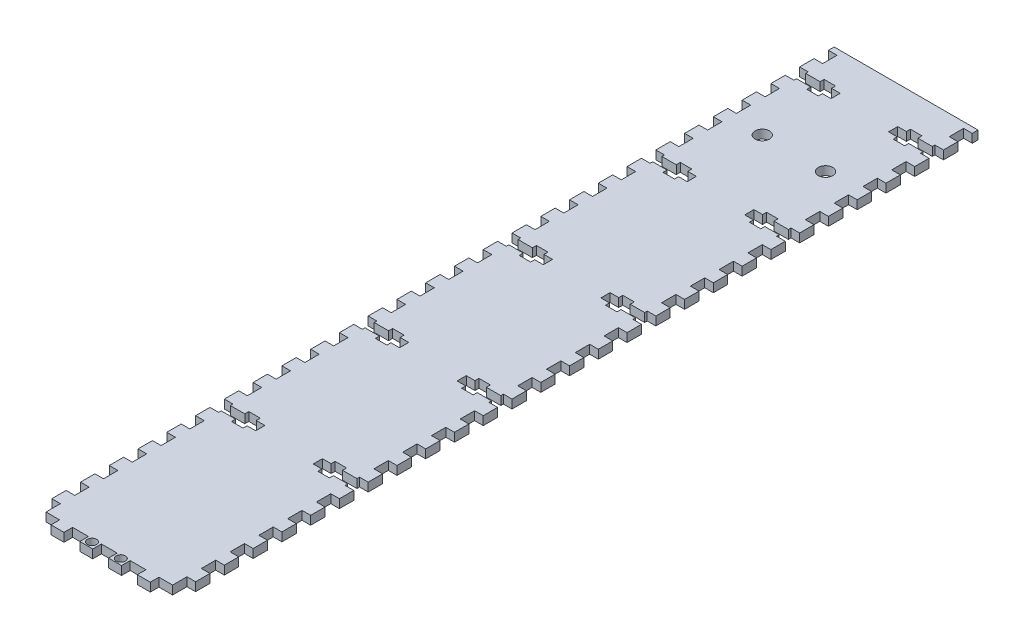
from build123d import *

# Parameters (mm, degrees)
SKETCH1_W           = 50
SKETCH1_H           = 3
BOSS_EXTRUDE1_DEPTH = 277
SKETCH3_W           = 3
SKETCH3_H           = 5
CUT_EXTRUDE1_DEPTH  = 3
SKETCH6_W           = 4.5
SKETCH6_H           = 3
BOSS_EXTRUDE2_DEPTH = 3
SKETCH9_W           = 3.2
SKETCH9_H           = 3
CUT_EXTRUDE2_DEPTH  = 12
SKETCH10_W          = 3.2
SKETCH10_H          = 3
CUT_EXTRUDE3_DEPTH  = 12
SKETCH11_W          = 4
SKETCH11_H          = 6
CUT_EXTRUDE4_DEPTH  = 12
SKETCH12_R          = 1.6
CUT_EXTRUDE5_DEPTH  = 12
SKETCH13_W          = 12.899245797
SKETCH13_H          = 11.071856066
SKETCH13_W_2        = 12.581238136
SKETCH13_H_2        = 10.989172341
BOSS_EXTRUDE3_DEPTH = 3
SKETCH15_R          = 2.5
CUT_EXTRUDE8_DEPTH  = 292.149515035


with BuildPart() as part:
    # Sketch1 → Boss-Extrude1 (new body)
    with BuildSketch(Plane.XY):
        with Locations((-54.743589744, 28.628205128)):
            Rectangle(SKETCH1_W, SKETCH1_H)
    extrude(amount=BOSS_EXTRUDE1_DEPTH)

    # Sketch3 → Cut-Extrude1 (cut)
    with BuildSketch(Plane(origin=(0, 30.128205128, 0), x_dir=(1, 0, 0), z_dir=(0, 1, 0))):
        with Locations((-78.243589744, -274.5)):
            Rectangle(SKETCH3_W, SKETCH3_H)
        with Locations((-31.243589744, -274.5)):
            Rectangle(SKETCH3_W, SKETCH3_H)
        with Locations((-78.243589744, -264.5)):
            Rectangle(SKETCH3_W, SKETCH3_H)
        with Locations((-31.243589744, -264.5)):
            Rectangle(SKETCH3_W, SKETCH3_H)
        with Locations((-78.243589744, -254.5)):
            Rectangle(SKETCH3_W, SKETCH3_H)
        with Locations((-31.243589744, -254.5)):
            Rectangle(SKETCH3_W, SKETCH3_H)
        with Locations((-78.243589744, -244.5)):
            Rectangle(SKETCH3_W, SKETCH3_H)
        with Locations((-31.243589744, -244.5)):
            Rectangle(SKETCH3_W, SKETCH3_H)
        with Locations((-78.243589744, -234.5)):
            Rectangle(SKETCH3_W, SKETCH3_H)
        with Locations((-31.243589744, -234.5)):
            Rectangle(SKETCH3_W, SKETCH3_H)
        with Locations((-78.243589744, -224.5)):
            Rectangle(SKETCH3_W, SKETCH3_H)
        with Locations((-31.243589744, -224.5)):
            Rectangle(SKETCH3_W, SKETCH3_H)
        with Locations((-78.243589744, -214.5)):
            Rectangle(SKETCH3_W, SKETCH3_H)
        with Locations((-31.243589744, -214.5)):
            Rectangle(SKETCH3_W, SKETCH3_H)
        with Locations((-78.243589744, -204.5)):
            Rectangle(SKETCH3_W, SKETCH3_H)
        with Locations((-31.243589744, -204.5)):
            Rectangle(SKETCH3_W, SKETCH3_H)
        with Locations((-78.243589744, -194.5)):
            Rectangle(SKETCH3_W, SKETCH3_H)
        with Locations((-31.243589744, -194.5)):
            Rectangle(SKETCH3_W, SKETCH3_H)
        with Locations((-78.243589744, -184.5)):
            Rectangle(SKETCH3_W, SKETCH3_H)
        with Locations((-31.243589744, -184.5)):
            Rectangle(SKETCH3_W, SKETCH3_H)
        with Locations((-78.243589744, -174.5)):
            Rectangle(SKETCH3_W, SKETCH3_H)
        with Locations((-31.243589744, -174.5)):
            Rectangle(SKETCH3_W, SKETCH3_H)
        with Locations((-78.243589744, -164.5)):
            Rectangle(SKETCH3_W, SKETCH3_H)
        with Locations((-31.243589744, -164.5)):
            Rectangle(SKETCH3_W, SKETCH3_H)
        with Locations((-78.243589744, -154.5)):
            Rectangle(SKETCH3_W, SKETCH3_H)
        with Locations((-31.243589744, -154.5)):
            Rectangle(SKETCH3_W, SKETCH3_H)
        with Locations((-78.243589744, -144.5)):
            Rectangle(SKETCH3_W, SKETCH3_H)
        with Locations((-31.243589744, -144.5)):
            Rectangle(SKETCH3_W, SKETCH3_H)
        with Locations((-78.243589744, -134.5)):
            Rectangle(SKETCH3_W, SKETCH3_H)
        with Locations((-31.243589744, -134.5)):
            Rectangle(SKETCH3_W, SKETCH3_H)
        with Locations((-78.243589744, -124.5)):
            Rectangle(SKETCH3_W, SKETCH3_H)
        with Locations((-31.243589744, -124.5)):
            Rectangle(SKETCH3_W, SKETCH3_H)
        with Locations((-78.243589744, -114.5)):
            Rectangle(SKETCH3_W, SKETCH3_H)
        with Locations((-31.243589744, -114.5)):
            Rectangle(SKETCH3_W, SKETCH3_H)
        with Locations((-78.243589744, -104.5)):
            Rectangle(SKETCH3_W, SKETCH3_H)
        with Locations((-31.243589744, -104.5)):
            Rectangle(SKETCH3_W, SKETCH3_H)
        with Locations((-78.243589744, -94.5)):
            Rectangle(SKETCH3_W, SKETCH3_H)
        with Locations((-31.243589744, -94.5)):
            Rectangle(SKETCH3_W, SKETCH3_H)
        with Locations((-78.243589744, -84.5)):
            Rectangle(SKETCH3_W, SKETCH3_H)
        with Locations((-31.243589744, -84.5)):
            Rectangle(SKETCH3_W, SKETCH3_H)
        with Locations((-78.243589744, -74.5)):
            Rectangle(SKETCH3_W, SKETCH3_H)
        with Locations((-31.243589744, -74.5)):
            Rectangle(SKETCH3_W, SKETCH3_H)
        with Locations((-78.243589744, -64.5)):
            Rectangle(SKETCH3_W, SKETCH3_H)
        with Locations((-31.243589744, -64.5)):
            Rectangle(SKETCH3_W, SKETCH3_H)
        with Locations((-78.243589744, -54.5)):
            Rectangle(SKETCH3_W, SKETCH3_H)
        with Locations((-31.243589744, -54.5)):
            Rectangle(SKETCH3_W, SKETCH3_H)
        with Locations((-78.243589744, -44.5)):
            Rectangle(SKETCH3_W, SKETCH3_H)
        with Locations((-31.243589744, -44.5)):
            Rectangle(SKETCH3_W, SKETCH3_H)
        with Locations((-78.243589744, -34.5)):
            Rectangle(SKETCH3_W, SKETCH3_H)
        with Locations((-31.243589744, -34.5)):
            Rectangle(SKETCH3_W, SKETCH3_H)
        with Locations((-78.243589744, -24.5)):
            Rectangle(SKETCH3_W, SKETCH3_H)
        with Locations((-31.243589744, -24.5)):
            Rectangle(SKETCH3_W, SKETCH3_H)
        with Locations((-78.243589744, -14.5)):
            Rectangle(SKETCH3_W, SKETCH3_H)
        with Locations((-31.243589744, -14.5)):
            Rectangle(SKETCH3_W, SKETCH3_H)
        with Locations((-78.243589744, -4.5)):
            Rectangle(SKETCH3_W, SKETCH3_H)
        with Locations((-31.243589744, -4.5)):
            Rectangle(SKETCH3_W, SKETCH3_H)
    extrude(amount=-CUT_EXTRUDE1_DEPTH, mode=Mode.SUBTRACT)

    # Sketch6 → Boss-Extrude2 (add)
    with BuildSketch(Plane.XY.offset(277)):
        with Locations((-69.743589744, 28.628205128)):
            Rectangle(SKETCH6_W, SKETCH6_H)
        with Locations((-59.743589744, 28.628205128)):
            Rectangle(SKETCH6_W, SKETCH6_H)
        with Locations((-49.743589744, 28.628205128)):
            Rectangle(SKETCH6_W, SKETCH6_H)
        with Locations((-39.743589744, 28.628205128)):
            Rectangle(SKETCH6_W, SKETCH6_H)
    extrude(amount=BOSS_EXTRUDE2_DEPTH)

    # Sketch9 → Cut-Extrude2 (cut)
    with BuildSketch(Plane(origin=(-32.743589744, 0, 0), x_dir=(0, 0, -1), z_dir=(1, 0, 0))):
        with Locations((-264.5, 28.628205128)):
            Rectangle(SKETCH9_W, SKETCH9_H)
        with Locations((-214.5, 28.628205128)):
            Rectangle(SKETCH9_W, SKETCH9_H)
        with Locations((-164.5, 28.628205128)):
            Rectangle(SKETCH9_W, SKETCH9_H)
        with Locations((-114.5, 28.628205128)):
            Rectangle(SKETCH9_W, SKETCH9_H)
        with Locations((-64.5, 28.628205128)):
            Rectangle(SKETCH9_W, SKETCH9_H)
        with Locations((-14.5, 28.628205128)):
            Rectangle(SKETCH9_W, SKETCH9_H)
    extrude(amount=-CUT_EXTRUDE2_DEPTH, mode=Mode.SUBTRACT)

    # Sketch10 → Cut-Extrude3 (cut)
    with BuildSketch(Plane.ZY.offset(76.743589744)):
        with Locations((264.5, 28.628205128)):
            Rectangle(SKETCH10_W, SKETCH10_H)
        with Locations((214.5, 28.628205128)):
            Rectangle(SKETCH10_W, SKETCH10_H)
        with Locations((164.5, 28.628205128)):
            Rectangle(SKETCH10_W, SKETCH10_H)
        with Locations((114.5, 28.628205128)):
            Rectangle(SKETCH10_W, SKETCH10_H)
        with Locations((64.5, 28.628205128)):
            Rectangle(SKETCH10_W, SKETCH10_H)
        with Locations((14.5, 28.628205128)):
            Rectangle(SKETCH10_W, SKETCH10_H)
    extrude(amount=-CUT_EXTRUDE3_DEPTH, mode=Mode.SUBTRACT)

    # Sketch11 → Cut-Extrude4 (cut)
    with BuildSketch(Plane.XZ.offset(-27.128205128)):
        with Locations((-69.743589744, 264.5)):
            Rectangle(SKETCH11_W, SKETCH11_H)
        with Locations((-39.743589744, 264.5)):
            Rectangle(SKETCH11_W, SKETCH11_H)
        with Locations((-69.743589744, 214.5)):
            Rectangle(SKETCH11_W, SKETCH11_H)
        with Locations((-39.743589744, 214.5)):
            Rectangle(SKETCH11_W, SKETCH11_H)
        with Locations((-69.743589744, 164.5)):
            Rectangle(SKETCH11_W, SKETCH11_H)
        with Locations((-39.743589744, 164.5)):
            Rectangle(SKETCH11_W, SKETCH11_H)
        with Locations((-69.743589744, 114.5)):
            Rectangle(SKETCH11_W, SKETCH11_H)
        with Locations((-39.743589744, 114.5)):
            Rectangle(SKETCH11_W, SKETCH11_H)
        with Locations((-69.743589744, 64.5)):
            Rectangle(SKETCH11_W, SKETCH11_H)
        with Locations((-39.743589744, 64.5)):
            Rectangle(SKETCH11_W, SKETCH11_H)
        with Locations((-69.743589744, 14.5)):
            Rectangle(SKETCH11_W, SKETCH11_H)
        with Locations((-39.743589744, 14.5)):
            Rectangle(SKETCH11_W, SKETCH11_H)
    extrude(amount=-CUT_EXTRUDE4_DEPTH, mode=Mode.SUBTRACT)

    # Sketch12 → Cut-Extrude5 (cut)
    with BuildSketch(Plane.XZ.offset(-27.128205128)):
        with Locations(Location((-59.743589744, 278, 0), (0, 0, 270))):
            Circle(SKETCH12_R)
        with Locations(Location((-49.743589744, 278, 0), (0, 0, 270))):
            Circle(SKETCH12_R)
    extrude(amount=-CUT_EXTRUDE5_DEPTH, mode=Mode.SUBTRACT)

    # Sketch13 → Boss-Extrude3 (add)
    with BuildSketch(Plane.XZ.offset(-27.128205128)):
        with Locations((-70.293966846, 263.427568544)):
            Rectangle(SKETCH13_W, SKETCH13_H)
        with Locations((-39.034208812, 264.517331556)):
            Rectangle(SKETCH13_W_2, SKETCH13_H_2)
    extrude(amount=-BOSS_EXTRUDE3_DEPTH)

    # Sketch15 → Cut-Extrude8 (cut, through all)
    with BuildSketch(Plane.XZ.offset(-27.128205128)):
        with Locations(Location((-65.743589744, 39, 0), (0, 0, 270))):
            Circle(SKETCH15_R)
        with Locations(Location((-43.743589744, 39, 0), (0, 0, 90))):
            Circle(SKETCH15_R)
    extrude(amount=-CUT_EXTRUDE8_DEPTH, mode=Mode.SUBTRACT)


solid = part.part
